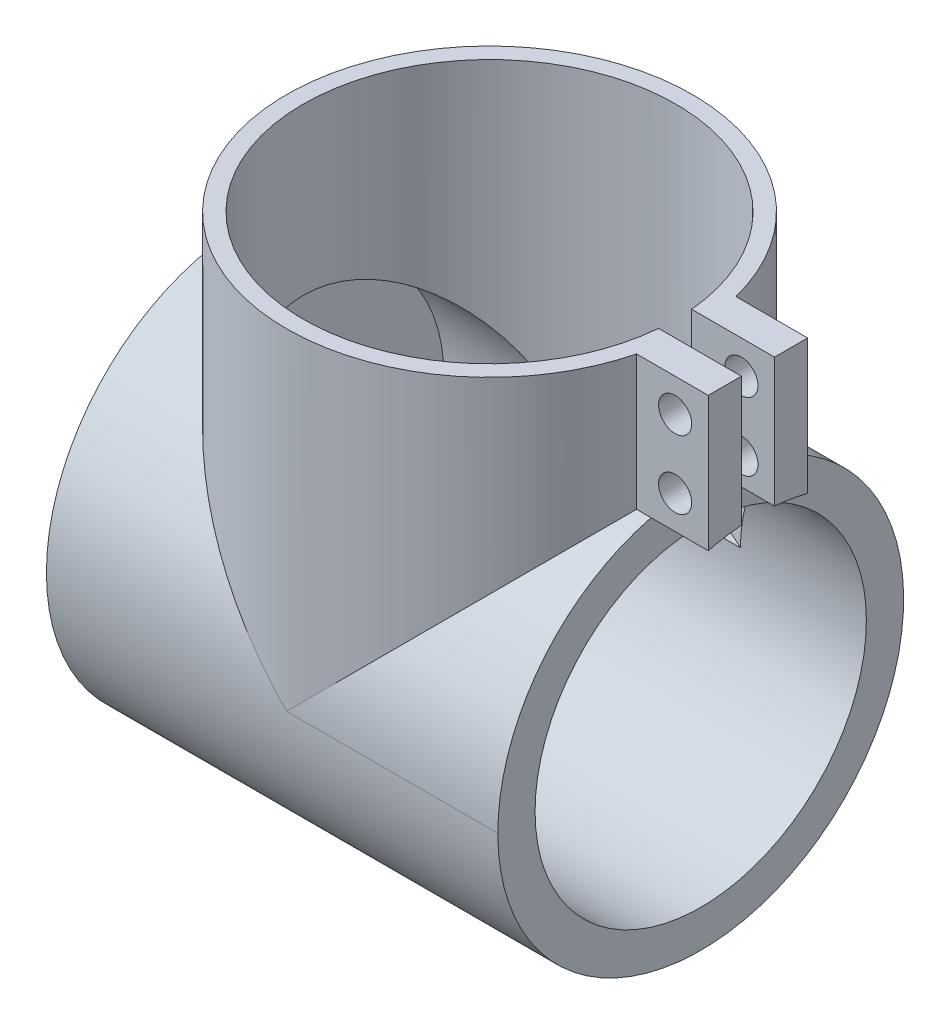
from build123d import *
from build123d.topology import SkipClean

# Parameters (mm, degrees)
SKETCH_1_R               = 24.5
EXTRUDE_1_DEPTH          = 55
SKETCH_2_R               = 24.5
EXTRUDE_2_DEPTH          = 40
SKETCH_3_R               = 20
CUT_EXTRUDE_1_DEPTH      = 51
SKETCH_4_R               = 1.5
CUT_EXTRUDE_2_DEPTH      = 73.285890739
PATTERN_CIRCULAR_1_COUNT = 4
SKETCH_5_R               = 22.5
CUT_EXTRUDE_3_DEPTH      = 40
CUT_EXTRUDE_5_REACH      = 90.235
CUT_EXTRUDE_5_END_RADIUS = 24.5
SKETCH_6_W               = 8
SKETCH_6_H               = 4
EXTRUDE_3_REACH          = 90.235
EXTRUDE_3_END_RADIUS     = 24.5
SKETCH_8_R               = 2
CUT_EXTRUDE_6_DEPTH      = 80.769755294
SKETCH_9_R               = 24.5
SKETCH_9_R_2             = 15
CUT_EXTRUDE_7_DEPTH      = 0.5


with BuildPart() as part:
    # Эскиз1 → Бобышка-Вытянуть1 (new body)
    with BuildSketch(Plane(origin=(0, 0, 0), x_dir=(0, 0, -1), z_dir=(1, 0, 0))):
        Circle(SKETCH_1_R)
    extrude(amount=EXTRUDE_1_DEPTH)

    # Эскиз2 → Бобышка-Вытянуть2 (add)
    with BuildSketch(Plane(origin=(0, 0, 0), x_dir=(1, 0, 0), z_dir=(0, 1, 0))):
        with Locations(Location((29.5, 0, 0), (0, 0, 270))):
            Circle(SKETCH_2_R)
    extrude(amount=EXTRUDE_2_DEPTH)

    # Эскиз3 → Вырез-Вытянуть1 (cut)
    with BuildSketch(Plane(origin=(55, 0, 0), x_dir=(0, 0, -1), z_dir=(1, 0, 0))):
        Circle(SKETCH_3_R)
    extrude(amount=-CUT_EXTRUDE_1_DEPTH, mode=Mode.SUBTRACT)

    # Эскиз4 → Вырез-Вытянуть2 (cut, through all)
    with BuildSketch(Plane.ZY):
        with Locations((7, 0)):
            Circle(SKETCH_4_R)
    cut_extrude_2 = extrude(amount=-CUT_EXTRUDE_2_DEPTH, mode=Mode.SUBTRACT)

    # Круговой массив1: Вырез-Вытянуть2 ×4 about axis
    pattern_circular_1_axis = Axis((0, 0, 0), (1, 0, 0))
    for i in range(1, PATTERN_CIRCULAR_1_COUNT):
        add(cut_extrude_2.rotate(pattern_circular_1_axis, i * 360 / PATTERN_CIRCULAR_1_COUNT), mode=Mode.SUBTRACT)

    # Эскиз5 → Вырез-Вытянуть3 (cut)
    with BuildSketch(Plane(origin=(0, 40, 0), x_dir=(1, 0, 0), z_dir=(0, 1, 0))):
        with Locations(Location((29.5, 0, 0), (0, 0, 270))):
            Circle(SKETCH_5_R)
    extrude(amount=-CUT_EXTRUDE_3_DEPTH, mode=Mode.SUBTRACT)

    # Вырез-Вытянуть5: up to this cylinder (the profile starts outside it)
    cut_extrude_5_end = Plane(origin=(52, 0, 0), z_dir=(-1, 0, 0)) * Cylinder(CUT_EXTRUDE_5_END_RADIUS, 230.47, mode=Mode.PRIVATE)
    # Эскиз6 → Вырез-Вытянуть5 (cut, up to the surface)
    with BuildSketch(Plane(origin=(0, 40, 0), x_dir=(1, 0, 0), z_dir=(0, 1, 0)), mode=Mode.PRIVATE) as cut_extrude_5_sk1:
        with Locations((52, 0)):
            Rectangle(SKETCH_6_W, SKETCH_6_H)
    cut_extrude_5_tool1 = extrude(cut_extrude_5_sk1.sketch, amount=-CUT_EXTRUDE_5_REACH, mode=Mode.PRIVATE) - cut_extrude_5_end
    add(cut_extrude_5_tool1.solids().sort_by_distance((52, 40, 0))[0], mode=Mode.SUBTRACT)

    # Бобышка-Вытянуть3: up to this cylinder (the profile starts outside it)
    extrude_3_end = Plane(origin=(56.758533, 0, 0), z_dir=(-1, 0, 0)) * Cylinder(EXTRUDE_3_END_RADIUS, 230.47, mode=Mode.PRIVATE)
    # Эскиз7 → Бобышка-Вытянуть3 (add, up to the surface)
    with BuildSketch(Plane(origin=(0, 40, 0), x_dir=(1, 0, 0), z_dir=(0, 1, 0)), mode=Mode.PRIVATE) as extrude_3_sk1:
        with BuildLine():
            Line((51.910934831, -2), (61.910934831, -2))
            Line((61.910934831, -2), (61.910934831, -6))
            Line((61.910934831, -6), (51.185248442, -6))
            ThreePointArc((51.185248442, -6), (51.638616597, -4.016423183), (51.910934831, -2))
        make_face()
    extrude_3_tool1 = extrude(extrude_3_sk1.sketch, amount=-EXTRUDE_3_REACH, mode=Mode.PRIVATE) - extrude_3_end
    add(extrude_3_tool1.solids().sort_by_distance((56.758533, 40, 4.023444))[0])
    # Эскиз7 → Бобышка-Вытянуть3 (add, up to the surface)
    with BuildSketch(Plane(origin=(0, 40, 0), x_dir=(1, 0, 0), z_dir=(0, 1, 0)), mode=Mode.PRIVATE) as extrude_3_sk2:
        with BuildLine():
            Line((51.910934831, 2), (61.910934831, 2))
            Line((61.910934831, 2), (61.910934831, 6))
            Line((61.910934831, 6), (51.185248442, 6))
            ThreePointArc((51.185248442, 6), (51.638616597, 4.016423183), (51.910934831, 2))
        make_face()
    extrude_3_tool2 = extrude(extrude_3_sk2.sketch, amount=-EXTRUDE_3_REACH, mode=Mode.PRIVATE) - extrude_3_end
    add(extrude_3_tool2.solids().sort_by_distance((56.758533, 40, -4.023444))[0])

    # Эскиз8 → Вырез-Вытянуть6 (cut, through all)
    with BuildSketch(Plane(origin=(0, 0, -6), x_dir=(-1, 0, 0), z_dir=(0, 0, -1))):
        with Locations((-57.910934831, 36)):
            Circle(SKETCH_8_R)
        with Locations((-57.910934831, 27.75394704)):
            Circle(SKETCH_8_R)
    extrude(amount=-CUT_EXTRUDE_6_DEPTH, mode=Mode.SUBTRACT)

    # Эскиз9 → Вырез-Вытянуть7 (cut)
    with SkipClean():  # the faces are left unmerged after this step: merging them gives an invalid solid
        with BuildSketch(Plane.ZY):
            Circle(SKETCH_9_R)
            Circle(SKETCH_9_R_2, mode=Mode.SUBTRACT)
        extrude(amount=-CUT_EXTRUDE_7_DEPTH, mode=Mode.SUBTRACT)


solid = part.part
